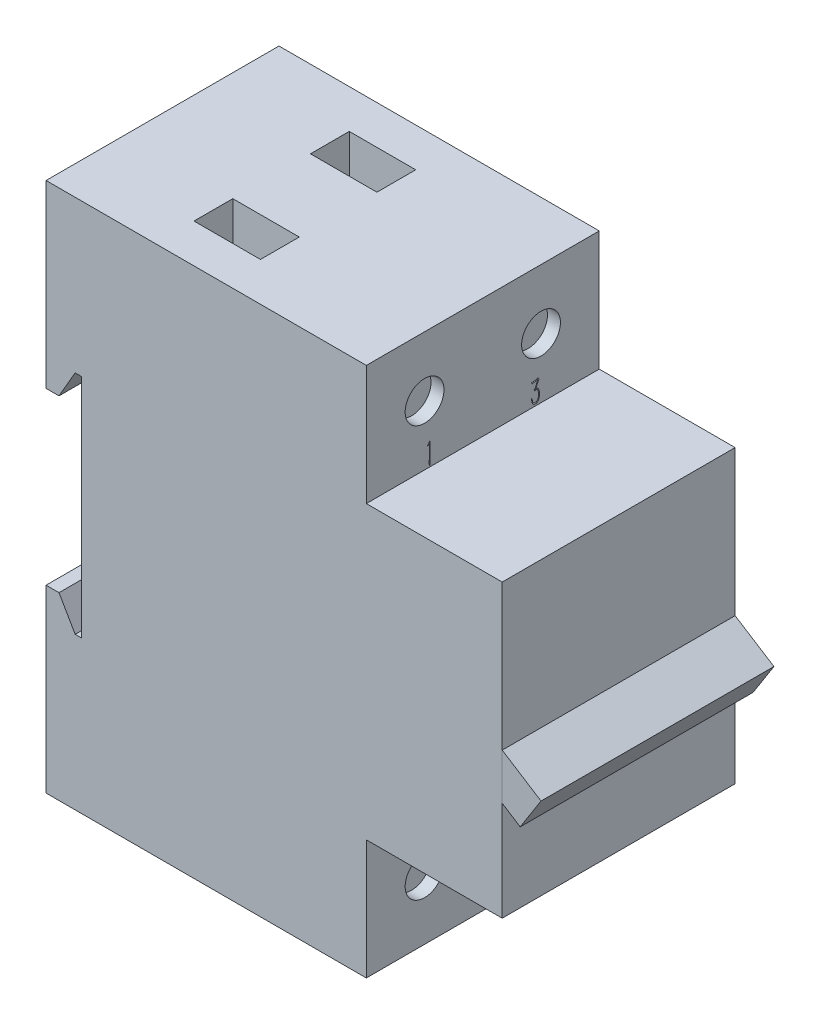
from build123d import *

# Parameters (mm, degrees)
EXTRUDE_1_DEPTH        = 18
SKETCH_2_R             = 3
CUT_EXTRUDE_1_DEPTH    = 2
SKETCH_7_W             = 10.27440821
SKETCH_7_H             = 6
CUT_EXTRUDE_2_DEPTH    = 8
EXTRUDE_3_DEPTH        = 18
PATTERN_LINEAR_1_COUNT = 2
PATTERN_LINEAR_1_PITCH = 18
CUT_EXTRUDE_3_DEPTH    = 1


with BuildPart() as part:
    # 草图1 → 凸台-拉伸1 (new body)
    with BuildSketch(Plane.XY):
        Polygon((0, 13.169872981), (2, 13.169872981), (4.5, 17.5), (5.5, 17.5), (5.5, -17.5), (4.5, -17.5), (2, -13.169872981), (0, -13.169872981), (0, -41), (49.5, -41), (49.5, -22.5), (70.5, -22.5), (70.5, 22.5), (49.5, 22.5), (49.5, 41), (0, 41), align=None)
    extrude(amount=-EXTRUDE_1_DEPTH)

    # 草图2 → 切除-拉伸1 (cut)
    with BuildSketch(Plane(origin=(49.5, 0, 0), x_dir=(0, 0, -1), z_dir=(1, 0, 0))):
        with Locations((9, 31.75)):
            Circle(SKETCH_2_R)
    cut_extrude_1 = extrude(amount=-CUT_EXTRUDE_1_DEPTH, mode=Mode.SUBTRACT)

    # 草图7 → 切除-拉伸2 (cut)
    with BuildSketch(Plane(origin=(0, 41, 0), x_dir=(1, 0, 0), z_dir=(0, 1, 0))):
        with Locations((22, 9)):
            Rectangle(SKETCH_7_W, SKETCH_7_H)
    cut_extrude_2 = extrude(amount=-CUT_EXTRUDE_2_DEPTH, mode=Mode.SUBTRACT)

    # 镜向1: 切除-拉伸1, 切除-拉伸2 across plane
    add(cut_extrude_1.mirror(Plane.ZX), mode=Mode.SUBTRACT)
    add(cut_extrude_2.mirror(Plane.ZX), mode=Mode.SUBTRACT)

    # 草图4 → 凸台-拉伸3 (add, through all)
    with BuildSketch(Plane.XY):
        Polygon((70.5, 0), (76.5, -3.811982778), (73.282472113, -8.876320276), (70.5, -7.10853098), align=None)
    extrude(amount=-EXTRUDE_3_DEPTH)


with BuildPart() as pattern_linear_1_1:
    # 阵列(线性)1: pattern copy
    add(part.part.moved(Location(Vector(0, 0, -1) * (1 * PATTERN_LINEAR_1_PITCH))))

    # Combine 1: union part
    add(part.part)

    # 草图10 → 切除-拉伸3 (cut)
    # profile 1 of 4: a face of its own
    with BuildSketch(Plane(origin=(49.5, 0, 0), x_dir=(0, 0, -1), z_dir=(1, 0, 0))):
        with BuildLine():
            add(Edge.make_bspline(
                [(26.050820371, 24.810462391), (26.061992005, 24.833589435), (26.083512697, 24.878140663), (26.114902646, 24.942493606), (26.144186608, 25.001577682), (26.169233232, 25.056404139), (26.19258807, 25.105764243), (26.213388578, 25.15018641), (26.231361618, 25.189685164), (26.250283433, 25.233537238), (26.269908245, 25.279285126), (26.288906711, 25.324094015), (26.30272262, 25.356102037), (26.309865473, 25.373034953), (26.312593224, 25.379501385)],
                knots=[0, 0, 0, 0, 1.475873638, 2.843077615, 4.114458223, 5.26483622, 6.306479236, 7.252326145, 8.083448402, 8.799989154, 9.996708352, 10.943956596, 11.596712522, 12, 12, 12, 12], degree=3))
            Line((26.312593224, 25.379501385), (26.473684211, 25.807585766))
            add(Edge.make_bspline(
                [(26.473684211, 25.807585766), (26.438648054, 25.804157075), (26.362200887, 25.796675841), (26.26464083, 25.790735725), (26.183523139, 25.786409905), (26.127862533, 25.781745782), (26.079122725, 25.777386359), (26.049075735, 25.774069735), (26.035158747, 25.772533561)],
                knots=[0, 0, 0, 0, 1.440114021, 3.142257811, 3.998086789, 4.76330671, 5.427195687, 6, 6, 6, 6], degree=3))
            Line((26.035158747, 25.772533561), (25.884508843, 25.747176646))
            add(Edge.make_bspline(
                [(25.884508843, 25.747176646), (25.877777398, 25.745761471), (25.859412177, 25.741900485), (25.825449213, 25.731357329), (25.776536273, 25.718391681), (25.739306857, 25.707729147), (25.718197315, 25.701683358)],
                knots=[0, 0, 0, 0, 0.478461291, 1.305373098, 2.472113022, 4, 4, 4, 4], degree=3))
            Line((25.718197315, 25.701683358), (25.668229278, 25.681546985))
            Line((25.668229278, 25.681546985), (25.542190496, 25.867994886))
            add(Edge.make_bspline(
                [(25.542190496, 25.867994886), (25.536868299, 25.875294714), (25.527782739, 25.8877563), (25.520240106, 25.905091621), (25.514641308, 25.917134887), (25.519659344, 25.929262471), (25.539502133, 25.927443918), (25.55448374, 25.91680722), (25.57361944, 25.90657335), (25.595635492, 25.905134019), (25.622326743, 25.903567608), (25.641889091, 25.906607977), (25.652567654, 25.908267633)],
                knots=[0, 0, 0, 0, 1.323589942, 2.259509366, 2.829398404, 3.190947808, 3.965341466, 5.19662492, 6.050472624, 7.088782, 8.410843841, 10, 10, 10, 10], degree=3))
            Line((25.652567654, 25.908267633), (25.813658641, 25.913488174))
            Line((25.813658641, 25.913488174), (26.448327296, 25.988813126))
            Line((26.448327296, 25.988813126), (26.498295333, 26.034306414))
            Line((26.498295333, 26.034306414), (26.53856808, 26.07457916))
            add(Edge.make_bspline(
                [(26.53856808, 26.07457916), (26.539817056, 26.073092428), (26.544937164, 26.066997649), (26.555959841, 26.052494818), (26.575559703, 26.029194078), (26.590378071, 26.009776485), (26.5989772, 25.998508417)],
                knots=[0, 0, 0, 0, 0.23984028, 0.983211964, 2.249351781, 4, 4, 4, 4], degree=3))
            Line((26.5989772, 25.998508417), (26.695184317, 25.877690177))
            add(Edge.make_bspline(
                [(26.695184317, 25.877690177), (26.701644777, 25.869302134), (26.712381037, 25.855362537), (26.720346063, 25.833069109), (26.712184348, 25.817964796), (26.700782925, 25.805017661), (26.682301156, 25.789467159), (26.667657954, 25.77864613), (26.65938632, 25.772533561)],
                knots=[0, 0, 0, 0, 1.419029252, 2.358201718, 2.827787952, 3.596253847, 4.642174893, 6, 6, 6, 6], degree=3))
            Line((26.65938632, 25.772533561), (26.604197741, 25.727040273))
            add(Edge.make_bspline(
                [(26.604197741, 25.727040273), (26.588069207, 25.686506975), (26.557467577, 25.609600733), (26.513376692, 25.500149867), (26.473031731, 25.402832313), (26.43760606, 25.31679816), (26.405067083, 25.243025268), (26.378204234, 25.180427165), (26.354018928, 25.13020579), (26.339225928, 25.10080722), (26.332729597, 25.087896868)],
                knots=[0, 0, 0, 0, 1.507300768, 2.859891598, 4.076963614, 5.147345159, 6.074452096, 6.862861548, 7.500626815, 8, 8, 8, 8], degree=3))
            Line((26.332729597, 25.087896868), (26.181333902, 24.8007671))
            add(Edge.make_bspline(
                [(26.181333902, 24.8007671), (26.19922936, 24.802195946), (26.23350232, 24.804932439), (26.28580709, 24.81015627), (26.342796143, 24.802970936), (26.392780472, 24.782980329), (26.435308411, 24.75831345), (26.469386057, 24.733676087), (26.501942108, 24.70165441), (26.535139273, 24.664010589), (26.568413985, 24.619080736), (26.599001918, 24.564661457), (26.630843565, 24.502519508), (26.670665213, 24.407816173), (26.7136942, 24.281101178), (26.739837913, 24.121946436), (26.752754908, 23.962489754), (26.754651216, 23.856371069), (26.755593437, 23.803643725)],
                knots=[0, 0, 0, 0, 0.660541429, 1.265053373, 1.928435853, 2.750244091, 3.225390118, 3.735570922, 4.291687282, 4.900607759, 5.580848831, 6.342918567, 7.193367346, 8.147740655, 10.119512469, 12.097611575, 14.061014616, 16, 16, 16, 16], degree=3))
            add(Edge.make_bspline(
                [(26.755593437, 23.803643725), (26.753603075, 23.762363845), (26.749822026, 23.683945329), (26.740684126, 23.573133948), (26.727047713, 23.475918021), (26.707188612, 23.366315493), (26.672165632, 23.245226268), (26.628899184, 23.133510275), (26.587818345, 23.053025261), (26.55319633, 22.999656143), (26.515275347, 22.951910647), (26.474524306, 22.910128162), (26.432134815, 22.875791728), (26.390993876, 22.846261269), (26.349363422, 22.8253901), (26.295469072, 22.807954302), (26.229608889, 22.795935699), (26.177154086, 22.793527826), (26.151502237, 22.792350309)],
                knots=[0, 0, 0, 0, 1.512752116, 2.8737433, 4.067977017, 5.104892351, 6.948544146, 8.672095895, 9.482011449, 10.251829035, 10.996496654, 11.710742831, 12.38300564, 12.991319199, 13.561044299, 14.079002633, 15.060579187, 16, 16, 16, 16], degree=3))
            add(Edge.make_bspline(
                [(26.151502237, 22.792350309), (26.129622302, 22.791977356), (26.087527817, 22.791259836), (26.026470871, 22.796230338), (25.970861417, 22.807606906), (25.918708984, 22.823082986), (25.86986654, 22.847556614), (25.82321256, 22.8825171), (25.77624696, 22.925566915), (25.73121635, 22.978396905), (25.690003722, 23.038922579), (25.653968486, 23.105872242), (25.624028166, 23.178298085), (25.594263711, 23.281370017), (25.569035812, 23.413168693), (25.564541393, 23.519872451), (25.56232687, 23.572448327)],
                knots=[0, 0, 0, 0, 0.828828519, 1.594571005, 2.314948186, 2.97625877, 3.650192192, 4.371738268, 5.178272596, 6.059897072, 6.995131469, 7.947518938, 8.935744196, 9.957858231, 12.008325587, 14, 14, 14, 14], degree=3))
            Line((25.56232687, 23.572448327), (25.557106329, 23.768591519))
            Line((25.557106329, 23.768591519), (25.612294907, 23.768591519))
            add(Edge.make_bspline(
                [(25.612294907, 23.768591519), (25.616515105, 23.739505045), (25.624597157, 23.683801866), (25.636353432, 23.603436334), (25.648529744, 23.530177708), (25.662252107, 23.443483121), (25.685106264, 23.34613445), (25.723608549, 23.241361869), (25.775823041, 23.152835647), (25.837129283, 23.079883965), (25.908830586, 23.026931873), (25.985588018, 22.993530791), (26.063817697, 22.977760235), (26.115649922, 22.977956297), (26.141061155, 22.978052418)],
                knots=[0, 0, 0, 0, 0.994021113, 1.903638599, 2.746793397, 3.505624798, 4.871908371, 6.122639036, 7.264652637, 8.331625701, 9.323760524, 10.250011688, 11.142051883, 12, 12, 12, 12], degree=3))
            add(Edge.make_bspline(
                [(26.141061155, 22.978052418), (26.16150411, 22.979815268), (26.201543354, 22.983267958), (26.259604604, 22.99641271), (26.313299581, 23.018841707), (26.363493714, 23.04752351), (26.40867344, 23.084925568), (26.449335437, 23.128997405), (26.483770948, 23.181353691), (26.522363455, 23.261508139), (26.559869449, 23.372011634), (26.58808973, 23.512370412), (26.606453129, 23.655540092), (26.615080154, 23.797993223), (26.616255631, 23.938334289), (26.604715744, 24.030183148), (26.5989772, 24.07585766)],
                knots=[0, 0, 0, 0, 0.647840119, 1.268849254, 1.871153999, 2.479976942, 3.088343857, 3.716462885, 4.367721208, 5.059616847, 6.52246665, 8.039623249, 9.575767262, 11.078710543, 12.547304005, 14, 14, 14, 14], degree=3))
            add(Edge.make_bspline(
                [(26.5989772, 24.07585766), (26.590953018, 24.125088053), (26.575091058, 24.222405208), (26.538399282, 24.339214311), (26.502268115, 24.426438384), (26.470032841, 24.484958794), (26.433495566, 24.537231368), (26.39210813, 24.581073147), (26.350152879, 24.617050157), (26.308040997, 24.641056719), (26.266453292, 24.653409977), (26.23980484, 24.650694047), (26.226827189, 24.649371404)],
                knots=[0, 0, 0, 0, 2.019199264, 3.991492233, 4.943861116, 5.841091039, 6.693606335, 7.520378909, 8.278781735, 8.923571305, 9.475785111, 10, 10, 10, 10], degree=3))
            Line((26.226827189, 24.649371404), (26.146281696, 24.639676113))
            Line((26.146281696, 24.639676113), (26.111229491, 24.574046452))
            add(Edge.make_bspline(
                [(26.111229491, 24.574046452), (26.106550965, 24.565867362), (26.098395147, 24.5516092), (26.087250309, 24.532763121), (26.078349065, 24.521724539), (26.071592819, 24.51220847), (26.061826104, 24.515409688), (26.055544135, 24.526348658), (26.04550183, 24.542452355), (26.038969404, 24.556283081), (26.035158747, 24.564351161)],
                knots=[0, 0, 0, 0, 1.659028505, 2.892093886, 3.763458346, 4.288089223, 4.647361994, 5.327919393, 6.441255868, 8, 8, 8, 8], degree=3))
            Line((26.035158747, 24.564351161), (25.954613254, 24.720221607))
            add(Edge.make_bspline(
                [(25.954613254, 24.720221607), (25.948791269, 24.729180034), (25.938641889, 24.744797127), (25.94304192, 24.762599317), (25.944917963, 24.770189644)],
                knots=[0, 0, 0, 0, 1.147259222, 2, 2, 2, 2], degree=3))
            Line((25.944917963, 24.770189644), (25.98519071, 24.785851268))
            Line((25.98519071, 24.785851268), (26.050820371, 24.810462391))
        make_face()
    # profile 2 of 4: a face of its own
    with BuildSketch(Plane(origin=(49.5, 0, 0), x_dir=(0, 0, -1), z_dir=(1, 0, 0))):
        with BuildLine():
            Line((9.822395056, 26.034306414), (9.877583635, 26.034306414))
            Line((9.877583635, 26.034306414), (9.872363094, 23.360643512))
            add(Edge.make_bspline(
                [(9.872363094, 23.360643512), (9.871768376, 23.336531223), (9.870628072, 23.290298592), (9.870535527, 23.224151689), (9.868360115, 23.164261802), (9.868186843, 23.110543188), (9.866569242, 23.063066024), (9.864698642, 23.021820374), (9.864520899, 22.986728926), (9.861212142, 22.931806279), (9.85726932, 22.856291737), (9.847491324, 22.778513041), (9.839707305, 22.723092466), (9.831794207, 22.697864051), (9.821769124, 22.677902503), (9.811764112, 22.680230387), (9.807479224, 22.68122736)],
                knots=[0, 0, 0, 0, 1.45038606, 2.780953852, 3.977268029, 5.053718292, 6.010937745, 6.833690271, 7.536464333, 8.120251454, 10.142880859, 12.069479857, 12.873132744, 13.440417135, 13.76034519, 14, 14, 14, 14], degree=3))
            add(Edge.make_bspline(
                [(9.807479224, 22.68122736), (9.806488695, 22.681977123), (9.802248988, 22.68518629), (9.792138461, 22.691978917), (9.780125069, 22.710186957), (9.774866358, 22.726522015), (9.771681227, 22.736415939)],
                knots=[0, 0, 0, 0, 0.221265066, 0.947068446, 2.150880552, 4, 4, 4, 4], degree=3))
            Line((9.771681227, 22.736415939), (9.747070104, 22.8020456))
            Line((9.747070104, 22.8020456), (9.691135734, 22.98327296))
            add(Edge.make_bspline(
                [(9.691135734, 22.98327296), (9.684402442, 23.000324587), (9.672673396, 23.030027641), (9.660841376, 23.069106135), (9.651865207, 23.094059404), (9.649479414, 23.114285114), (9.660971791, 23.133256883), (9.669435533, 23.162467624), (9.682458971, 23.199753211), (9.694757556, 23.243760308), (9.705620108, 23.291309282), (9.715405373, 23.342684453), (9.720950963, 23.400567186), (9.723671291, 23.455833044), (9.725758981, 23.509042479), (9.726138282, 23.560268342), (9.727184445, 23.620921331), (9.727021015, 23.664677216), (9.726933731, 23.688046026)],
                knots=[0, 0, 0, 0, 1.220359697, 2.125803599, 2.712350858, 2.994193817, 3.439826662, 4.12562012, 5.031064022, 6.063176816, 7.167225426, 8.277459231, 9.542238136, 11.034069985, 11.961482632, 13.08703073, 14.444263491, 16, 16, 16, 16], degree=3))
            Line((9.726933731, 23.688046026), (9.731408481, 25.661410612))
            Line((9.731408481, 25.661410612), (9.469635628, 25.434689964))
            Line((9.469635628, 25.434689964), (9.449499254, 25.520455998))
            add(Edge.make_bspline(
                [(9.449499254, 25.520455998), (9.470777693, 25.542443117), (9.510665004, 25.583658879), (9.563972133, 25.643002168), (9.607815381, 25.694502744), (9.653481049, 25.754709329), (9.704608975, 25.82963605), (9.742365335, 25.89119403), (9.761985937, 25.923183465)],
                knots=[0, 0, 0, 0, 1.077185482, 2.019228619, 2.808185376, 3.45765616, 4.678836699, 6, 6, 6, 6], degree=3))
            Line((9.761985937, 25.923183465), (9.822395056, 26.034306414))
        make_face()
    # profile 3 of 4: a face of its own
    with BuildSketch(Plane(origin=(49.5, 0, 0), x_dir=(0, 0, -1), z_dir=(1, 0, 0))):
        with BuildLine():
            Line((7.871872543, -24.264862561), (7.7958018, -24.264862561))
            add(Edge.make_bspline(
                [(7.7958018, -24.264862561), (7.794234396, -24.240753306), (7.791246264, -24.19479092), (7.788162921, -24.129151646), (7.786860809, -24.070215602), (7.785556392, -23.99836566), (7.787568131, -23.907753799), (7.792969819, -23.83476945), (7.7958018, -23.796505434)],
                knots=[0, 0, 0, 0, 0.927540379, 1.768282303, 2.522502339, 3.190652681, 4.527123766, 6, 6, 6, 6], degree=3))
            add(Edge.make_bspline(
                [(7.7958018, -23.796505434), (7.797761707, -23.768139156), (7.801551943, -23.713282026), (7.811554947, -23.63421952), (7.823131454, -23.560955145), (7.838182009, -23.49204459), (7.858517789, -23.42460873), (7.887467972, -23.356779876), (7.923574304, -23.286234811), (7.966232975, -23.215442866), (8.013039613, -23.148644983), (8.065578121, -23.094287734), (8.120563941, -23.052856537), (8.179067549, -23.028198661), (8.235239487, -23.01286498), (8.286463693, -23.000803406), (8.332495272, -22.992373995), (8.361578003, -22.991474395), (8.375281876, -22.991050501)],
                knots=[0, 0, 0, 0, 1.238521709, 2.395159043, 3.470603583, 4.46912877, 5.466066804, 6.534123646, 7.677244524, 8.916145015, 10.13365226, 11.221244199, 12.198275335, 13.109907183, 13.966820176, 14.733954848, 15.403435577, 16, 16, 16, 16], degree=3))
            add(Edge.make_bspline(
                [(8.375281876, -22.991050501), (8.392746072, -22.992338183), (8.427254782, -22.994882602), (8.478016138, -23.006671597), (8.527041189, -23.023669567), (8.589745884, -23.053949588), (8.663068931, -23.101424485), (8.72544731, -23.163766889), (8.768611377, -23.220833206), (8.79901623, -23.269401053), (8.825959727, -23.323633808), (8.85979583, -23.402435847), (8.895193099, -23.50700687), (8.920719801, -23.639080796), (8.937086892, -23.776233689), (8.944575358, -23.91644525), (8.945967758, -24.055274867), (8.937816025, -24.145817291), (8.933879788, -24.189537609)],
                knots=[0, 0, 0, 0, 0.570779476, 1.127842599, 1.694919432, 2.261066821, 3.397481896, 4.527710891, 5.118384485, 5.730727279, 6.394748858, 7.092559246, 8.529363642, 9.986910621, 11.474321506, 13.03467297, 14.568129345, 16, 16, 16, 16], degree=3))
            add(Edge.make_bspline(
                [(8.933879788, -24.189537609), (8.925900414, -24.234509857), (8.909822611, -24.325125345), (8.875192925, -24.434225144), (8.842896816, -24.517169107), (8.815895575, -24.572750012), (8.787045015, -24.6219546), (8.745327278, -24.6801439), (8.681618845, -24.746195261), (8.622582587, -24.790490068), (8.591561442, -24.813765182)],
                knots=[0, 0, 0, 0, 1.490916612, 3.004077927, 3.729534125, 4.397912905, 5.020560084, 5.590839424, 6.734084393, 8, 8, 8, 8], degree=3))
            Line((8.591561442, -24.813765182), (8.344704421, -24.969635628))
            add(Edge.make_bspline(
                [(8.344704421, -24.969635628), (8.313247417, -24.990991392), (8.253598933, -25.031485997), (8.173951741, -25.097632031), (8.10710124, -25.167328115), (8.056572146, -25.244391364), (8.017327234, -25.323717163), (7.982479002, -25.40336802), (7.956170358, -25.491161597), (7.937458627, -25.569853451), (7.924697846, -25.63594277), (7.918305716, -25.682034871), (7.913112975, -25.722771633), (7.912454362, -25.748228452), (7.91214529, -25.760174728)],
                knots=[0, 0, 0, 0, 1.453572249, 2.75625039, 3.953730064, 5.132566341, 6.263730064, 7.337486329, 8.453238547, 9.76321854, 10.430854957, 11.026567013, 11.543191201, 12, 12, 12, 12], degree=3))
            Line((7.91214529, -25.760174728), (7.901704208, -25.971233752))
            Line((7.901704208, -25.971233752), (8.802620466, -25.941402088))
            add(Edge.make_bspline(
                [(8.802620466, -25.941402088), (8.814180744, -25.940755724), (8.834485185, -25.939620451), (8.853998999, -25.918347064), (8.858342549, -25.892372243), (8.866049907, -25.860423962), (8.8717798, -25.81462895), (8.876200012, -25.779802597), (8.87869121, -25.760174728)],
                knots=[0, 0, 0, 0, 0.925905201, 1.626257371, 2.181371879, 3.087088273, 4.358305093, 6, 6, 6, 6], degree=3))
            Line((8.87869121, -25.760174728), (8.898827583, -25.321649265))
            Line((8.898827583, -25.321649265), (8.968931994, -25.321649265))
            Line((8.968931994, -25.321649265), (8.994288908, -25.986149584))
            add(Edge.make_bspline(
                [(8.994288908, -25.986149584), (8.995136604, -25.999068195), (8.996619224, -26.021662858), (8.997340943, -26.051552331), (8.997361371, -26.072364854), (8.997046602, -26.089168854), (8.991634412, -26.103860909), (8.986605399, -26.120908527), (8.966987691, -26.130539629), (8.938788628, -26.133621158), (8.895932324, -26.137985434), (8.862296475, -26.137706301), (8.842893213, -26.13754528)],
                knots=[0, 0, 0, 0, 1.385018147, 2.4223982, 3.193529914, 3.619812046, 4.200562765, 4.878496499, 5.402948042, 6.404258339, 7.925751149, 10, 10, 10, 10], degree=3))
            Line((8.842893213, -26.13754528), (7.841295088, -26.162902195))
            add(Edge.make_bspline(
                [(7.841295088, -26.162902195), (7.829119648, -26.162937814), (7.805120958, -26.163008021), (7.780527965, -26.139144046), (7.770204333, -26.109929903), (7.765037396, -26.075568207), (7.761576459, -26.029981614), (7.759914038, -25.951575476), (7.763468241, -25.840015589), (7.771473981, -25.747961164), (7.775665426, -25.699765608)],
                knots=[0, 0, 0, 0, 0.556373901, 1.096654043, 1.476064089, 2.012759395, 2.73145082, 3.635924119, 5.715166189, 8, 8, 8, 8], degree=3))
            add(Edge.make_bspline(
                [(7.775665426, -25.699765608), (7.779384986, -25.671633927), (7.78655015, -25.617442544), (7.801118605, -25.539436814), (7.816650941, -25.467030035), (7.833507624, -25.400266013), (7.852116573, -25.339496475), (7.872428189, -25.284790992), (7.89348431, -25.235268508), (7.925111695, -25.17924562), (7.965307639, -25.118178785), (8.011028319, -25.052334036), (8.055048429, -24.996480007), (8.112584858, -24.935031572), (8.190478168, -24.867959994), (8.255913503, -24.818848521), (8.289515842, -24.793628809)],
                knots=[0, 0, 0, 0, 1.103491021, 2.125706759, 3.085324024, 3.98349739, 4.803138144, 5.555704107, 6.252741852, 6.89323317, 8.054555834, 9.09539633, 10.010480884, 10.817709087, 12.365830683, 14, 14, 14, 14], degree=3))
            Line((8.289515842, -24.793628809), (8.496100116, -24.662369486))
            add(Edge.make_bspline(
                [(8.496100116, -24.662369486), (8.512639398, -24.651373167), (8.544378076, -24.630271365), (8.588215931, -24.596675584), (8.625589346, -24.561817573), (8.657796538, -24.524201226), (8.686952092, -24.480673778), (8.710896401, -24.426417496), (8.736209879, -24.362508819), (8.76572399, -24.263078861), (8.79615517, -24.131840057), (8.807820786, -23.969689346), (8.801588909, -23.805435751), (8.782536885, -23.696415737), (8.772788802, -23.640634988)],
                knots=[0, 0, 0, 0, 0.635613896, 1.219735276, 1.765761318, 2.268061313, 2.802129131, 3.435697723, 4.161225462, 5.001884758, 6.75303811, 8.46119913, 10.189351173, 12, 12, 12, 12], degree=3))
            add(Edge.make_bspline(
                [(8.772788802, -23.640634988), (8.765443456, -23.612197988), (8.751117592, -23.556736394), (8.724002852, -23.476841805), (8.688904482, -23.404075735), (8.651336965, -23.33610105), (8.604271968, -23.276599716), (8.541580683, -23.233865922), (8.467519435, -23.205299367), (8.413345499, -23.200268961), (8.384977167, -23.197634775)],
                knots=[0, 0, 0, 0, 1.101106684, 2.147523679, 3.156537618, 4.125318695, 5.058520457, 5.968677808, 6.93629249, 8, 8, 8, 8], degree=3))
            add(Edge.make_bspline(
                [(8.384977167, -23.197634775), (8.370044771, -23.197481899), (8.340261061, -23.197176976), (8.295899539, -23.203904277), (8.252751847, -23.218009595), (8.19607343, -23.243574701), (8.130580381, -23.291195576), (8.061644019, -23.36304645), (8.004782482, -23.450777932), (7.961003454, -23.552442718), (7.928084884, -23.668266624), (7.90136145, -23.798073758), (7.883814072, -23.943510229), (7.878911635, -24.04530483), (7.876347293, -24.098551033)],
                knots=[0, 0, 0, 0, 0.469335518, 0.936122588, 1.403629858, 1.893624907, 2.887406355, 3.927357629, 5.011993806, 6.157121359, 7.396943717, 8.794309501, 10.323183677, 12, 12, 12, 12], degree=3))
            Line((7.876347293, -24.098551033), (7.871872543, -24.264862561))
        make_face()
    # profile 4 of 4: a face of its own
    with BuildSketch(Plane(origin=(49.5, 0, 0), x_dir=(0, 0, -1), z_dir=(1, 0, 0))):
        with BuildLine():
            Line((26.216376728, -25.226187939), (25.50638312, -25.266460686))
            Line((25.50638312, -25.266460686), (25.456415083, -25.341785638))
            add(Edge.make_bspline(
                [(25.456415083, -25.341785638), (25.453154385, -25.349679137), (25.448226461, -25.361608661), (25.430006672, -25.373911461), (25.41633821, -25.356264142), (25.409879287, -25.344755436), (25.405701253, -25.337310889)],
                knots=[0, 0, 0, 0, 1.282902353, 1.938863145, 2.666728425, 4, 4, 4, 4], degree=3))
            Line((25.405701253, -25.337310889), (25.310239928, -25.145642446))
            add(Edge.make_bspline(
                [(25.310239928, -25.145642446), (25.306156139, -25.134324094), (25.299422012, -25.115660249), (25.294519319, -25.090608831), (25.295913283, -25.072940484), (25.299148735, -25.063813956), (25.300544637, -25.059876412)],
                knots=[0, 0, 0, 0, 1.63130738, 2.690008936, 3.434818089, 4, 4, 4, 4], degree=3))
            Line((25.300544637, -25.059876412), (25.340817384, -25.050181121))
            Line((25.340817384, -25.050181121), (25.396005963, -25.019603665))
            Line((25.396005963, -25.019603665), (26.246954183, -22.965693586))
            Line((26.246954183, -22.965693586), (26.357331341, -22.965693586))
            Line((26.357331341, -22.965693586), (26.357331341, -25.039740038))
            add(Edge.make_bspline(
                [(26.357331341, -25.039740038), (26.367702887, -25.039818671), (26.385338459, -25.039952376), (26.401420881, -25.032935126), (26.40804517, -25.030044747)],
                knots=[0, 0, 0, 0, 1.176207474, 2, 2, 2, 2], degree=3))
            Line((26.40804517, -25.030044747), (26.483370122, -24.999467292))
            add(Edge.make_bspline(
                [(26.483370122, -24.999467292), (26.493107767, -24.995832951), (26.51046481, -24.989354853), (26.532814247, -24.979625936), (26.548635508, -24.97213511), (26.556007463, -24.966477643), (26.558695074, -24.964415086)],
                knots=[0, 0, 0, 0, 1.495147538, 2.665053038, 3.513315187, 4, 4, 4, 4], degree=3))
            Line((26.558695074, -24.964415086), (26.593747279, -24.934583422))
            Line((26.593747279, -24.934583422), (26.734701893, -25.080012785))
            add(Edge.make_bspline(
                [(26.734701893, -25.080012785), (26.741882639, -25.08865431), (26.75363723, -25.102800135), (26.758767611, -25.126739108), (26.753875038, -25.142928321), (26.744729005, -25.15458685), (26.728786534, -25.159473801), (26.717051653, -25.160154501), (26.71009077, -25.160558278)],
                knots=[0, 0, 0, 0, 1.690587597, 2.767423091, 3.557953073, 4.202677464, 4.933866242, 6, 6, 6, 6], degree=3))
            Line((26.71009077, -25.160558278), (26.357331341, -25.200831025))
            Line((26.357331341, -25.200831025), (26.357331341, -26.102493075))
            add(Edge.make_bspline(
                [(26.357331341, -26.102493075), (26.357313388, -26.105227995), (26.357252969, -26.114432053), (26.358411405, -26.13380777), (26.358881145, -26.164637828), (26.35948562, -26.202948049), (26.360520843, -26.241389457), (26.360186375, -26.272524967), (26.358168215, -26.292159334), (26.353421538, -26.304777672), (26.34413007, -26.307037073), (26.339360934, -26.304850067), (26.337194967, -26.303856808)],
                knots=[0, 0, 0, 0, 0.375701713, 1.264380521, 2.665139726, 4.612257271, 6.525225464, 7.960129458, 8.858599367, 9.286556546, 9.675980055, 10, 10, 10, 10], degree=3))
            add(Edge.make_bspline(
                [(26.337194967, -26.303856808), (26.332984111, -26.30135393), (26.320290334, -26.293808916), (26.309165174, -26.269460333), (26.295797571, -26.244187941), (26.289788199, -26.225889707), (26.28722693, -26.218090773)],
                knots=[0, 0, 0, 0, 0.572299195, 1.725216547, 3.030459198, 4, 4, 4, 4], degree=3))
            Line((26.28722693, -26.218090773), (26.241733642, -26.127104198))
            Line((26.241733642, -26.127104198), (26.216376728, -26.056999787))
            add(Edge.make_bspline(
                [(26.216376728, -26.056999787), (26.212520659, -26.048598807), (26.205543028, -26.033397069), (26.197899463, -26.012442495), (26.191074939, -25.996972424), (26.187275904, -25.978567756), (26.191732286, -25.949816389), (26.201553891, -25.909552736), (26.213349121, -25.866509844), (26.218890963, -25.827178262), (26.221166055, -25.793271253), (26.221451472, -25.771364901), (26.221597269, -25.760174728)],
                knots=[0, 0, 0, 0, 0.908031708, 1.643101311, 2.192199313, 2.565975908, 3.473020803, 5.002279505, 6.661670863, 7.846934984, 8.900174221, 10, 10, 10, 10], degree=3))
            Line((26.221597269, -25.760174728), (26.216376728, -25.226187939))
        make_face()
        Polygon((26.221597269, -25.059876412), (26.221597269, -23.388557426), (25.511603661, -25.095674409), align=None, mode=Mode.SUBTRACT)
    extrude(amount=-CUT_EXTRUDE_3_DEPTH, mode=Mode.SUBTRACT)


solid = pattern_linear_1_1.part
